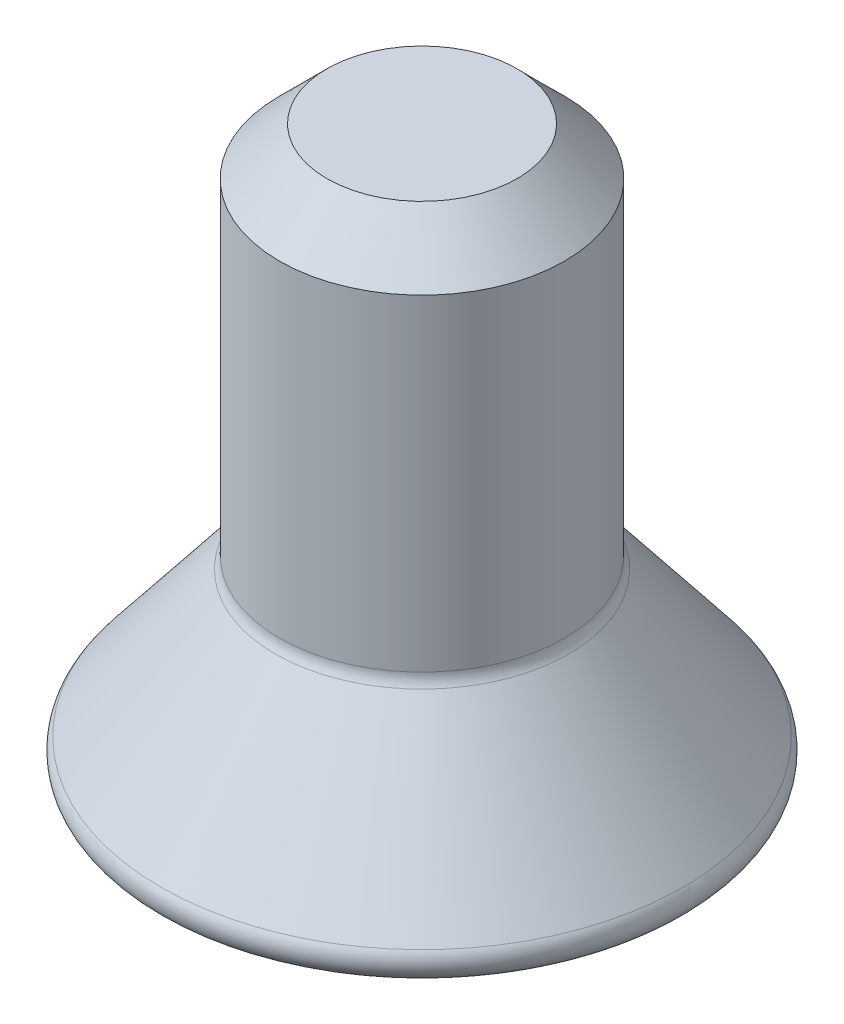
from build123d import *

# Parameters (mm, degrees)
SKETCH_2_R          = 1.5
EXTRUDE_1_DEPTH     = 4
CUT_EXTRUDE_1_DEPTH = 1
CHAMFER_1_SIZE      = 0.5
FILLET_1_R          = 0.2


with BuildPart() as part:
    # 草图1 → 旋转2 (revolve)
    with BuildSketch(Plane.XY, mode=Mode.PRIVATE) as revolve_2_sk:
        Polygon((0, 1.9), (1.5, 1.9), (3, 0), (0, 0), align=None)
    revolve(revolve_2_sk.sketch.rotate(Axis((0, 3.310292653, 0), (0, -1, 0)), 90), axis=Axis((0, 3.310292653, 0), (0, -1, 0)))

    # 草图2 → 凸台-拉伸1 (add)
    with BuildSketch(Plane(origin=(0, 1.9, 0), x_dir=(1, 0, 0), z_dir=(0, 1, 0))):
        with Locations(Location((0, 0, 0), (0, 0, 270))):
            Circle(SKETCH_2_R)
    extrude(amount=EXTRUDE_1_DEPTH)

    # 草图3 → 切除-拉伸1 (cut)
    with BuildSketch(Plane.XZ):
        Polygon((0, 1.154700538), (-1, 0.577350269), (-1, -0.577350269), (0, -1.154700538), (1, -0.577350269), (1, 0.577350269), align=None)
    extrude(amount=-CUT_EXTRUDE_1_DEPTH, mode=Mode.SUBTRACT)

    # 倒角1
    chamfer_1_edges = [part.edges().sort_by_distance(p)[0] for p in [
        (0, 5.9, -1.5),
    ]]
    chamfer(chamfer_1_edges, length=CHAMFER_1_SIZE)

    # 圆角1
    fillet_1_edges = [part.edges().sort_by_distance(p)[0] for p in [
        (0, 0, -3),
        (0, 1.9, -1.5),
    ]]
    fillet(fillet_1_edges, radius=FILLET_1_R)


solid = part.part
